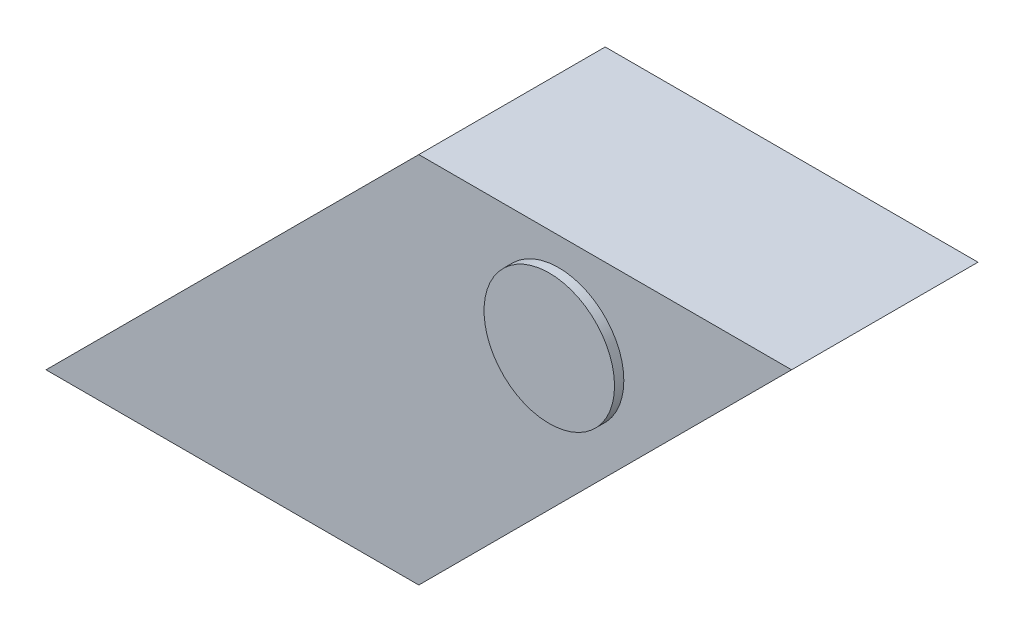
from build123d import *

# Parameters (mm, degrees)
BOSS_EXTRU_1_DEPTH      = 200
ESQUISSE2_R             = 70
BOSS_EXTRU_2_DEPTH      = 10
ESQUISSE3_R             = 50
ENL_V_MAT_EXTRU_1_DEPTH = 10


with BuildPart() as part:
    # Esquisse1 → Boss.-Extru.1 (new body)
    with BuildSketch(Plane.XY):
        Polygon((0, 0), (400, 400), (800, 400), (400, 0), align=None)
    extrude(amount=BOSS_EXTRU_1_DEPTH)

    # Esquisse2 → Boss.-Extru.2 (add)
    with BuildSketch(Plane.XY.offset(200)):
        with Locations((550, 300)):
            Circle(ESQUISSE2_R)
    extrude(amount=BOSS_EXTRU_2_DEPTH)

    # Esquisse3 → Enlèv. mat.-Extru.1 (cut)
    with BuildSketch(Plane(origin=(0, 0, 0), x_dir=(-1, 0, 0), z_dir=(0, -1, 0))):
        with Locations(Location((-200, -100, 0), (0, 0, 90))):
            Circle(ESQUISSE3_R)
    extrude(amount=-ENL_V_MAT_EXTRU_1_DEPTH, mode=Mode.SUBTRACT)


solid = part.part
